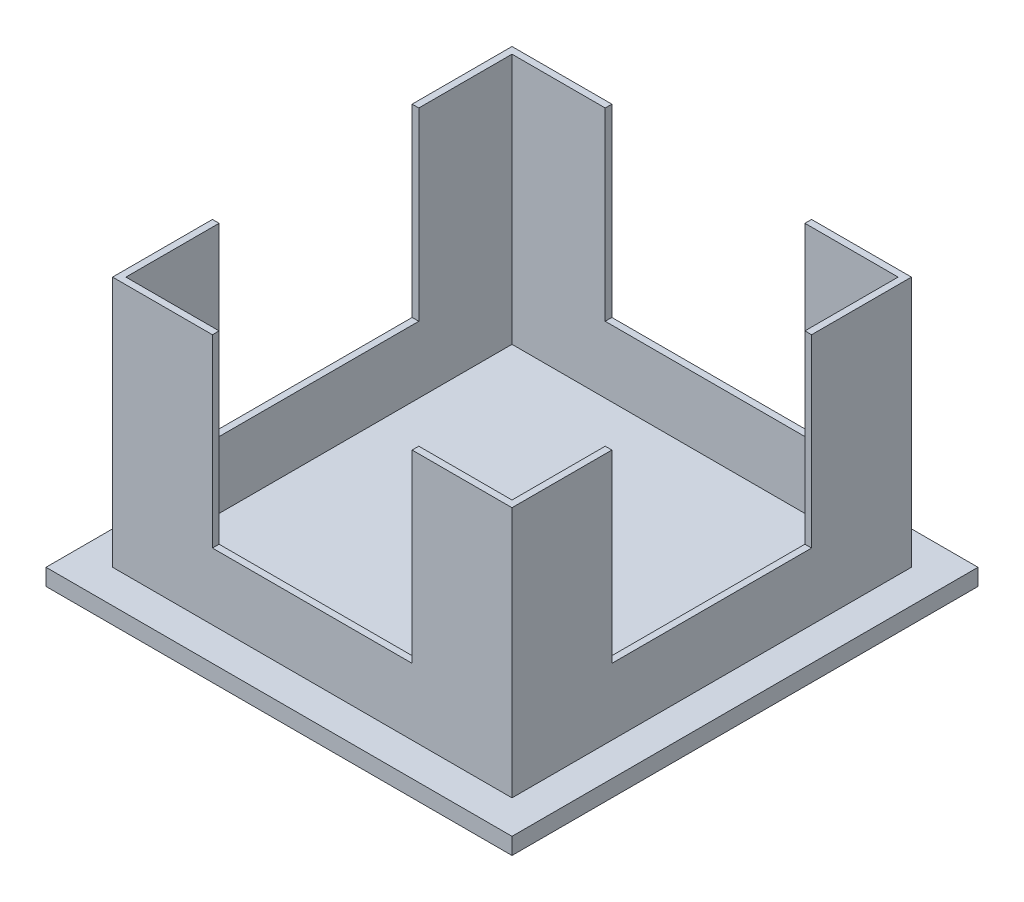
from build123d import *

# Parameters (mm, degrees)
SKETCH1_W               = 140
SKETCH1_H               = 140
SKETCH1_R               = 10.5
BOSS_EXTRUDE1_DEPTH     = 5
SKETCH2_W               = 120
SKETCH2_H               = 120
SKETCH2_W_2             = 116
SKETCH2_H_2             = 116
BOSS_EXTRUDE2_DEPTH     = 75.5
CUT_EXTRUDE1_DEPTH      = 128.594082935
CUT_EXTRUDE1_DEPTH_BACK = 128.594082935
SKETCH4_W               = 60
SKETCH4_H               = 55.5
CUT_EXTRUDE2_DEPTH      = 128.594082935
CUT_EXTRUDE2_DEPTH_BACK = 128.594082935
SKETCH6_W               = 60
SKETCH6_H               = 55.5


with BuildPart() as part:
    # Sketch1 → Boss-Extrude1 (new body)
    with BuildSketch(Plane(origin=(0, 0, 0), x_dir=(1, 0, 0), z_dir=(0, 1, 0))):
        Rectangle(SKETCH1_W, SKETCH1_H)
        with Locations(Location((0, 0, 0), (0, 0, 270))):
            Circle(SKETCH1_R, mode=Mode.SUBTRACT)
    extrude(amount=BOSS_EXTRUDE1_DEPTH)

    # Sketch2 → Boss-Extrude2 (add)
    with BuildSketch(Plane(origin=(0, 5, 0), x_dir=(1, 0, 0), z_dir=(0, 1, 0))):
        Rectangle(SKETCH2_W, SKETCH2_H)
        Rectangle(SKETCH2_W_2, SKETCH2_H_2, mode=Mode.SUBTRACT)
    extrude(amount=BOSS_EXTRUDE2_DEPTH)

    # Sketch4 → Cut-Extrude1 (cut, two sides: drawn at the far end of the back side and taken through both)
    with BuildSketch(Plane(origin=(0, 0, 0), x_dir=(-1, 0, 0), z_dir=(0, 0, -1)).offset(-CUT_EXTRUDE1_DEPTH_BACK)):
        with Locations((0, 52.75)):
            Rectangle(SKETCH4_W, SKETCH4_H)
    extrude(amount=CUT_EXTRUDE1_DEPTH + CUT_EXTRUDE1_DEPTH_BACK, mode=Mode.SUBTRACT)

    # Sketch6 → Cut-Extrude2 (cut, two sides: drawn at the far end of the back side and taken through both)
    with BuildSketch(Plane(origin=(0, 0, 0), x_dir=(0, 0, -1), z_dir=(1, 0, 0)).offset(-CUT_EXTRUDE2_DEPTH_BACK)):
        with Locations((0, 52.75)):
            Rectangle(SKETCH6_W, SKETCH6_H)
    extrude(amount=CUT_EXTRUDE2_DEPTH + CUT_EXTRUDE2_DEPTH_BACK, mode=Mode.SUBTRACT)


solid = part.part
